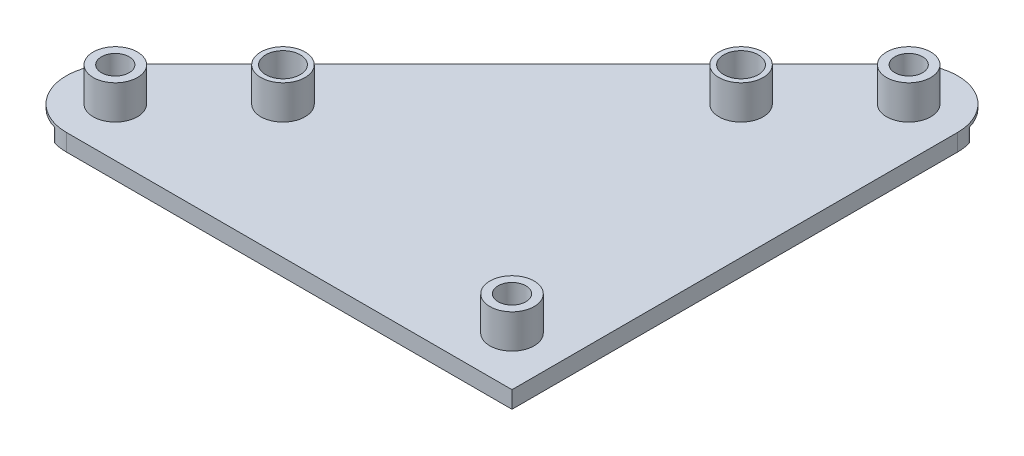
from build123d import *

# Parameters (mm, degrees)
SKETCH1_R           = 4.075
SKETCH1_R_2         = 5.075
BOSS_EXTRUDE1_DEPTH = 1
BOSS_EXTRUDE3_START = 4
BOSS_EXTRUDE3_DEPTH = 4
FILLET2_R           = 0.75
SKETCH4_R           = 6.5
SKETCH4_R_2         = 4.075
SKETCH4_R_3         = 5.075
BOSS_EXTRUDE4_DEPTH = 10


with BuildPart() as part:
    # Sketch1 → Boss-Extrude1 (new body)
    with BuildSketch(Plane(origin=(0, 0, 0), x_dir=(1, 0, 0), z_dir=(0, 1, 0))):
        with BuildLine():
            Line((14.4, -14.4), (14.4, 116.534474513))
            ThreePointArc((14.4, 116.534474513), (5.510641426, 129.838339781), (-10.182337649, 126.716812162))
            Line((-10.182337649, 126.716812162), (-126.716812162, 10.182337649))
            ThreePointArc((-126.716812162, 10.182337649), (-129.838339781, -5.510641426), (-116.534474513, -14.4))
            Line((-116.534474513, -14.4), (14.4, -14.4))
        make_face()
        with Locations(Location((-116.534474513, 0, 0), (0, 0, 270))):
            Circle(SKETCH1_R, mode=Mode.SUBTRACT)
        with Locations(Location((0, 116.534474513, 0), (0, 0, 270))):
            Circle(SKETCH1_R, mode=Mode.SUBTRACT)
        with Locations(Location((0, 0, 0), (0, 0, 270))):
            Circle(SKETCH1_R, mode=Mode.SUBTRACT)
        with Locations(Location((-91.907842371, 24.626632142, 0), (0, 0, 270))):
            Circle(SKETCH1_R_2, mode=Mode.SUBTRACT)
        with Locations(Location((-24.626632142, 91.907842371, 0), (0, 0, 270))):
            Circle(SKETCH1_R_2, mode=Mode.SUBTRACT)
    extrude(amount=BOSS_EXTRUDE1_DEPTH)

    # Sketch3 → Boss-Extrude3 (add)
    with BuildSketch(Plane.XZ.offset(BOSS_EXTRUDE3_START)):
        with BuildLine():
            Line((12.4, 12.4), (12.4, -123.8556766))
            ThreePointArc((12.4, -123.8556766), (13.891004283, -120.329207705), (14.4, -116.534474513))
            Line((14.4, -116.534474513), (14.4, 14.4))
            Line((14.4, 14.4), (-116.534474513, 14.4))
            ThreePointArc((-116.534474513, 14.4), (-120.329207705, 13.891004283), (-123.8556766, 12.4))
            Line((-123.8556766, 12.4), (12.4, 12.4))
        make_face()
    extrude(amount=-BOSS_EXTRUDE3_DEPTH)

    # Fillet2
    fillet2_edges = [part.edges().sort_by_distance(p)[0] for p in [
        (-123.8556766, -2, 12.4),
        (12.4, -2, -123.8556766),
    ]]
    fillet(fillet2_edges, radius=FILLET2_R)

    # Sketch4 → Boss-Extrude4 (add)
    # profile 1 of 5: a face of its own
    with BuildSketch(Plane(origin=(0, 1, 0), x_dir=(1, 0, 0), z_dir=(0, 1, 0))):
        with Locations(Location((-116.534474513, 0, 0), (0, 0, 270))):
            Circle(SKETCH4_R)
        with Locations(Location((-116.534474513, 0, 0), (0, 0, 270))):
            Circle(SKETCH4_R_2, mode=Mode.SUBTRACT)
    # profile 2 of 5: a face of its own
    with BuildSketch(Plane(origin=(0, 1, 0), x_dir=(1, 0, 0), z_dir=(0, 1, 0))):
        with Locations(Location((0, 116.534474513, 0), (0, 0, 270))):
            Circle(SKETCH4_R)
        with Locations(Location((0, 116.534474513, 0), (0, 0, 270))):
            Circle(SKETCH4_R_2, mode=Mode.SUBTRACT)
    # profile 3 of 5: a face of its own
    with BuildSketch(Plane(origin=(0, 1, 0), x_dir=(1, 0, 0), z_dir=(0, 1, 0))):
        with Locations(Location((-91.907842371, 24.626632142, 0), (0, 0, 270))):
            Circle(SKETCH4_R)
        with Locations(Location((-91.907842371, 24.626632142, 0), (0, 0, 270))):
            Circle(SKETCH4_R_3, mode=Mode.SUBTRACT)
    # profile 4 of 5: a face of its own
    with BuildSketch(Plane(origin=(0, 1, 0), x_dir=(1, 0, 0), z_dir=(0, 1, 0))):
        with Locations(Location((-24.626632142, 91.907842371, 0), (0, 0, 270))):
            Circle(SKETCH4_R)
        with Locations(Location((-24.626632142, 91.907842371, 0), (0, 0, 270))):
            Circle(SKETCH4_R_3, mode=Mode.SUBTRACT)
    # profile 5 of 5: a face of its own
    with BuildSketch(Plane(origin=(0, 1, 0), x_dir=(1, 0, 0), z_dir=(0, 1, 0))):
        with Locations(Location((0, 0, 0), (0, 0, 270))):
            Circle(SKETCH4_R)
        with Locations(Location((0, 0, 0), (0, 0, 270))):
            Circle(SKETCH4_R_2, mode=Mode.SUBTRACT)
    extrude(amount=BOSS_EXTRUDE4_DEPTH)


solid = part.part
